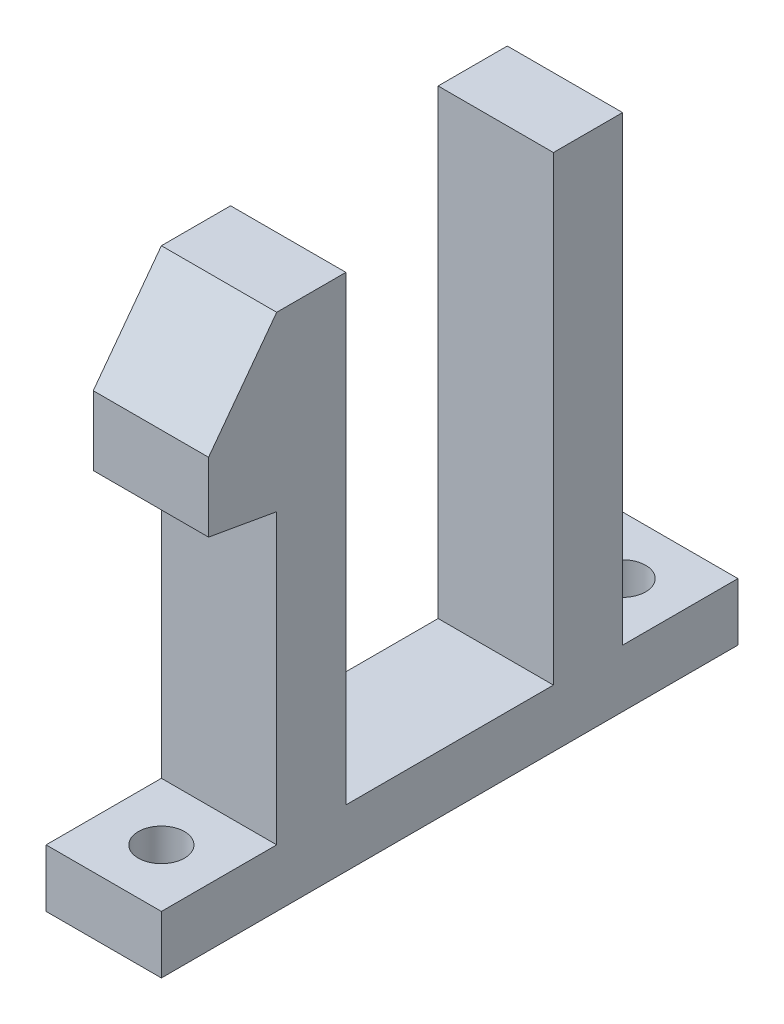
from build123d import *

# Parameters (mm, degrees)
SKETCH_1_W          = 5
SKETCH_1_H          = 25
SKETCH_1_R          = 1
EXTRUDE_1_DEPTH     = 2.5
SKETCH_3_W          = 5
SKETCH_3_H          = 15
EXTRUDE_2_DEPTH     = 20
SKETCH_6_W          = 9
SKETCH_6_H          = 20
CUT_EXTRUDE_1_DEPTH = 27.220221204
EXTRUDE_3_DEPTH     = 5


with BuildPart() as part:
    # 草图1 → 凸台-拉伸1 (new body)
    with BuildSketch(Plane(origin=(0, 0, 0), x_dir=(1, 0, 0), z_dir=(0, 1, 0))):
        Rectangle(SKETCH_1_W, SKETCH_1_H)
        with Locations(Location((0, 10, 0), (0, 0, 270))):
            Circle(SKETCH_1_R, mode=Mode.SUBTRACT)
        with Locations(Location((0, -10, 0), (0, 0, 90))):
            Circle(SKETCH_1_R, mode=Mode.SUBTRACT)
    extrude(amount=EXTRUDE_1_DEPTH)

    # 草图3 → 凸台-拉伸2 (add)
    with BuildSketch(Plane(origin=(0, 2.5, 0), x_dir=(1, 0, 0), z_dir=(0, 1, 0))):
        Rectangle(SKETCH_3_W, SKETCH_3_H)
    extrude(amount=EXTRUDE_2_DEPTH)

    # 草图6 → 切除-拉伸1 (cut, through all)
    with BuildSketch(Plane(origin=(2.5, 0, 0), x_dir=(0, 0, -1), z_dir=(1, 0, 0))):
        with Locations((0, 12.5)):
            Rectangle(SKETCH_6_W, SKETCH_6_H)
    extrude(amount=-CUT_EXTRUDE_1_DEPTH, mode=Mode.SUBTRACT)

    # 草图5 → 凸台-拉伸3 (add)
    with BuildSketch(Plane(origin=(2.5, 0, 0), x_dir=(0, 0, -1), z_dir=(1, 0, 0))):
        Polygon((-7.5, 15.011970436), (-10.454423259, 15.532914969), (-10.454423259, 18.532914969), (-7.5, 22.5), align=None)
    extrude(amount=-EXTRUDE_3_DEPTH)


solid = part.part
